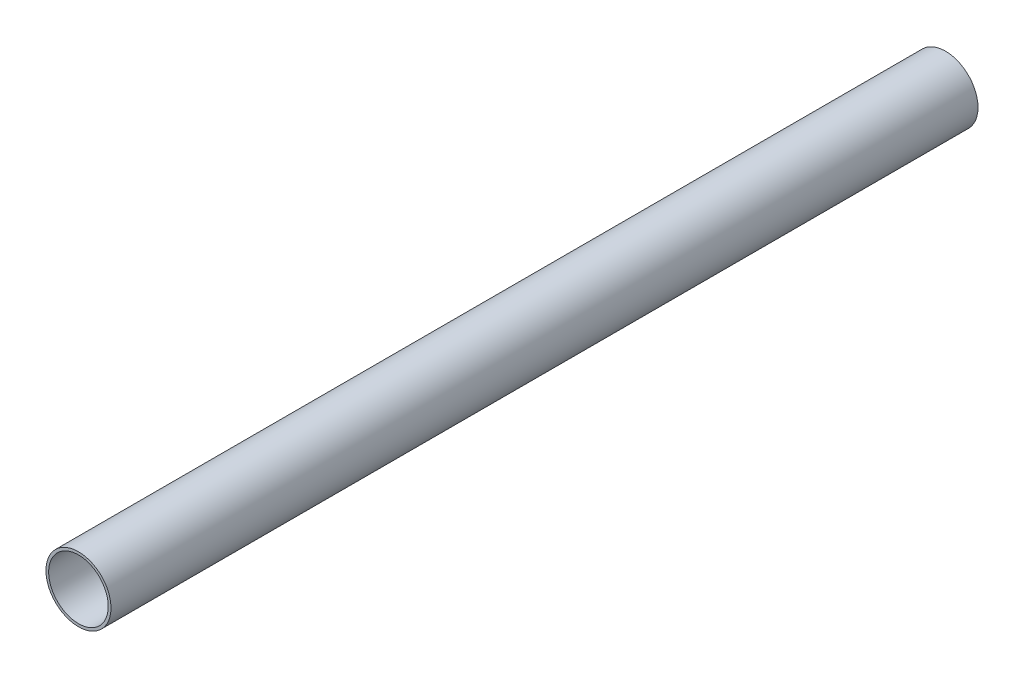
from build123d import *

# Parameters (mm, degrees)
IZIM1_R                     = 12
IZIM1_R_2                   = 11
Y_KSEKLIK_EKSTR_ZYON1_DEPTH = 320


with BuildPart() as part:
    # Çizim1 → Yükseklik-Ekstrüzyon1 (new body)
    with BuildSketch(Plane.XY):
        Circle(IZIM1_R)
        Circle(IZIM1_R_2, mode=Mode.SUBTRACT)
    extrude(amount=Y_KSEKLIK_EKSTR_ZYON1_DEPTH)


solid = part.part
